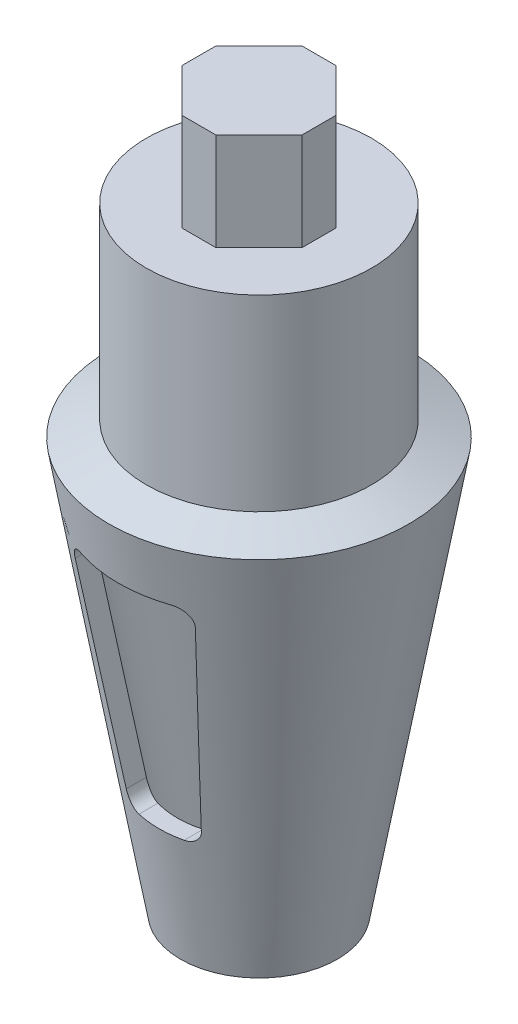
from build123d import *

# Parameters (mm, degrees)
BOSS_EXTRUDE1_DEPTH     = 26
CUT_EXTRUDE1_DEPTH      = 174.481987538
CUT_EXTRUDE1_DEPTH_BACK = 174.481987538


with BuildPart() as part:
    # Sketch1 → Revolve1 (revolve)
    with BuildSketch(Plane.XY, mode=Mode.PRIVATE) as revolve1_sk:
        with BuildLine():
            ThreePointArc((31.66780037, -73.791452413), (30.995225405, -69.840051309), (27.984645692, -67.193858277))
            Line((27.984645692, -67.193858277), (20, -64))
            Line((20, -64), (20, -8))
            Line((20, -8), (0, -8))
            Line((0, -8), (0, 0))
            Line((0, 0), (30, 0))
            Line((30, 0), (30, -50))
            Line((30, -50), (40, -54))
            Line((40, -54), (20.894736842, -164))
            Line((20.894736842, -164), (16, -164))
            Line((16, -164), (31.66780037, -73.791452413))
        make_face()
    revolve(revolve1_sk.sketch.rotate(Axis((0, 95.722418972, 0), (0, -1, 0)), 90), axis=Axis((0, 95.722418972, 0), (0, -1, 0)))

    # Sketch2 → Boss-Extrude1 (add)
    with BuildSketch(Plane(origin=(0, 0, 0), x_dir=(1, 0, 0), z_dir=(0, 1, 0))):
        Polygon((4.506096654, 16), (16, 4.506096654), (16, -4.506096654), (4.506096654, -16), (-4.506096654, -16), (-16, -4.506096654), (-16, 4.506096654), (-4.506096654, 16), align=None)
    extrude(amount=BOSS_EXTRUDE1_DEPTH)

    # Sketch3 → Cut-Extrude1 (cut, two sides: drawn at the far end of the back side and taken through both)
    with BuildSketch(Plane.XY.offset(-CUT_EXTRUDE1_DEPTH_BACK)):
        with BuildLine():
            Line((-12.024465061, -69), (12.024465061, -69))
            ThreePointArc((12.024465061, -69), (15.004977133, -70.332314151), (16, -73.441726104))
            Line((16, -73.441726104), (10, -127.441726104))
            ThreePointArc((10, -127.441726104), (8.692150911, -129.980512072), (6.024465061, -131))
            Line((6.024465061, -131), (-6.024465061, -131))
            ThreePointArc((-6.024465061, -131), (-8.692150911, -129.980512072), (-10, -127.441726104))
            Line((-10, -127.441726104), (-16, -73.441726104))
            ThreePointArc((-16, -73.441726104), (-15.004977133, -70.332314151), (-12.024465061, -69))
        make_face()
    extrude(amount=CUT_EXTRUDE1_DEPTH + CUT_EXTRUDE1_DEPTH_BACK, mode=Mode.SUBTRACT)


solid = part.part
